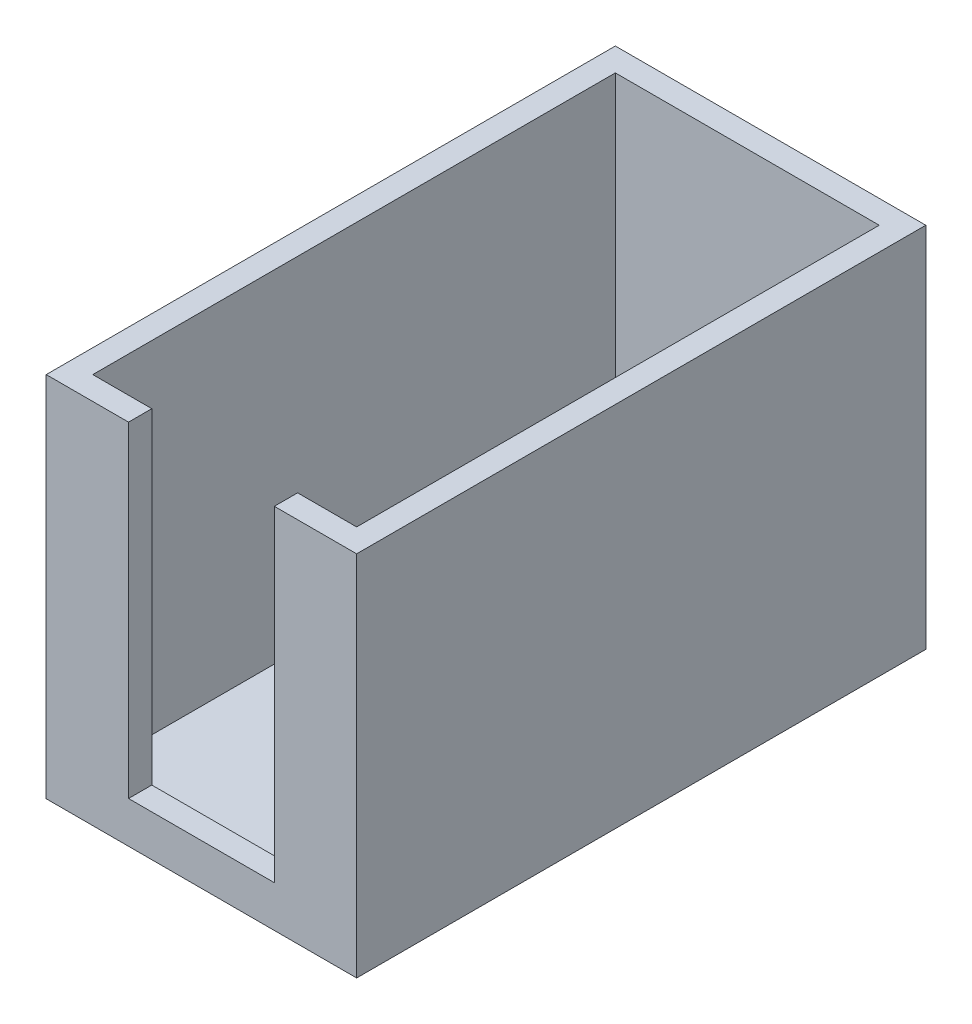
from build123d import *

# Parameters (mm, degrees)
SKETCH1_W           = 24
SKETCH1_H           = 44
SKETCH1_W_2         = 20.4
SKETCH1_H_2         = 40.4
EXTRUDE_THIN1_DEPTH = 28.4
SKETCH1_2_W         = 20.4
SKETCH1_2_H         = 40.4
BOSS_EXTRUDE1_DEPTH = 2
SKETCH3_W           = 11.27257677
SKETCH3_H           = 19.344298407
CUT_EXTRUDE1_DEPTH  = 25.2


with BuildPart() as part:
    # Sketch1 → Extrude-Thin1 (new body)
    with BuildSketch(Plane(origin=(0, 0, 0), x_dir=(1, 0, 0), z_dir=(0, 1, 0))):
        Rectangle(SKETCH1_W, SKETCH1_H)
        Rectangle(SKETCH1_W_2, SKETCH1_H_2, mode=Mode.SUBTRACT)
    extrude(amount=EXTRUDE_THIN1_DEPTH)

    # Sketch1<2> → Boss-Extrude1 (add)
    with BuildSketch(Plane(origin=(0, 0, 0), x_dir=(1, 0, 0), z_dir=(0, 1, 0))):
        Rectangle(SKETCH1_2_W, SKETCH1_2_H)
    extrude(amount=BOSS_EXTRUDE1_DEPTH)

    # Sketch3 → Cut-Extrude1 (cut)
    with BuildSketch(Plane(origin=(0, 28.4, 0), x_dir=(1, 0, 0), z_dir=(0, 1, 0))):
        with Locations((0, -24.608973671)):
            Rectangle(SKETCH3_W, SKETCH3_H)
    extrude(amount=-CUT_EXTRUDE1_DEPTH, mode=Mode.SUBTRACT)


solid = part.part
